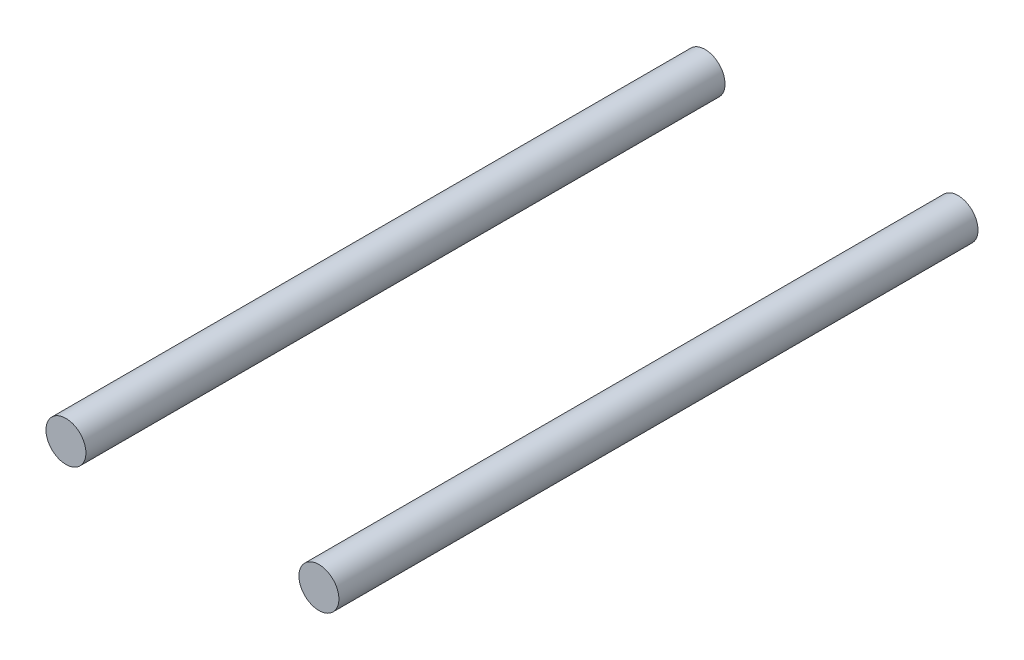
from build123d import *

# Parameters (mm, degrees)
BOSS_EXTRUDE1_DEPTH        = 19
BOSS_EXTRUDE1_DEPTH_BACK   = 29
SKETCH1_R                  = 1.5
BOSS_EXTRUDE1_2_DEPTH      = 19
BOSS_EXTRUDE1_2_DEPTH_BACK = 29


with BuildPart() as part:
    # Sketch1 → Boss-Extrude1 (new, two sides: drawn at the far end of the back side and taken through both)
    with BuildSketch(Plane.XY.offset(-BOSS_EXTRUDE1_DEPTH_BACK)):
        with Locations((-9.5, 0)):
            Circle(SKETCH1_R)
    extrude(amount=BOSS_EXTRUDE1_DEPTH + BOSS_EXTRUDE1_DEPTH_BACK)


with BuildPart() as body_2:
    # Sketch1 → Boss-Extrude1 2 (new, two sides: drawn at the far end of the back side and taken through both)
    with BuildSketch(Plane.XY.offset(-BOSS_EXTRUDE1_2_DEPTH_BACK)):
        with Locations((9.5, 0)):
            Circle(SKETCH1_R)
    extrude(amount=BOSS_EXTRUDE1_2_DEPTH + BOSS_EXTRUDE1_2_DEPTH_BACK)


solid = Compound([part.part, body_2.part])
